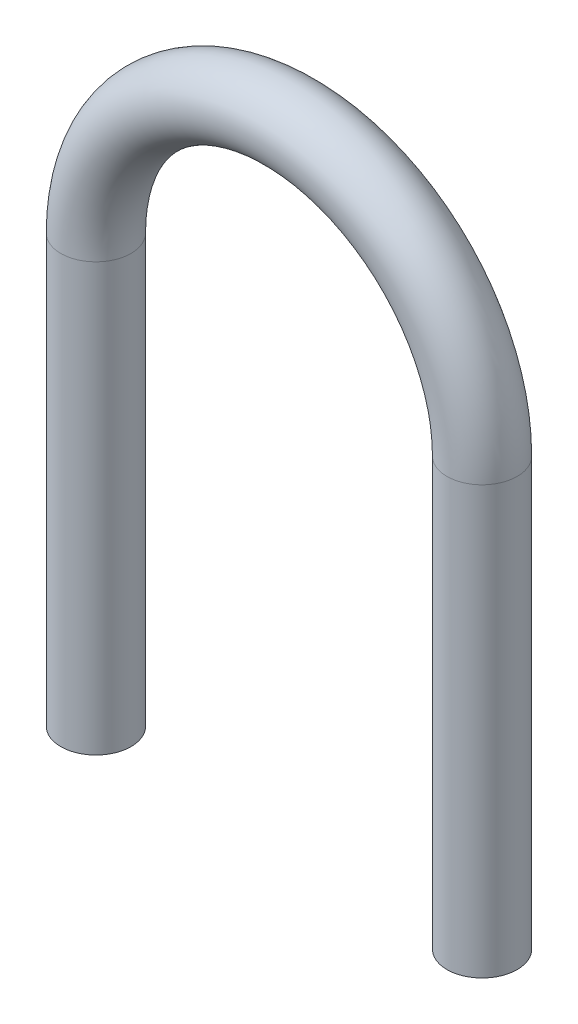
from build123d import *

# Parameters (mm, degrees)
SKETCH4_R = 3


with BuildPart() as part:
    # Sweep2: sweep along a path in Sketch5
    with BuildLine(Plane.XY) as sweep2_path:
        Line((-16.5, 0), (-16.5, 36.5))
        ThreePointArc((-16.5, 36.5), (0, 53), (16.5, 36.5))
        Line((16.5, 36.5), (16.5, 0))
    # Sketch4 → Sweep2 (sweep)
    with BuildSketch(Plane(origin=(0, 0, 0), x_dir=(1, 0, 0), z_dir=(0, 1, 0))):
        with Locations((-16.5, 0)):
            Circle(SKETCH4_R)
    sweep(path=sweep2_path.line)


solid = part.part
